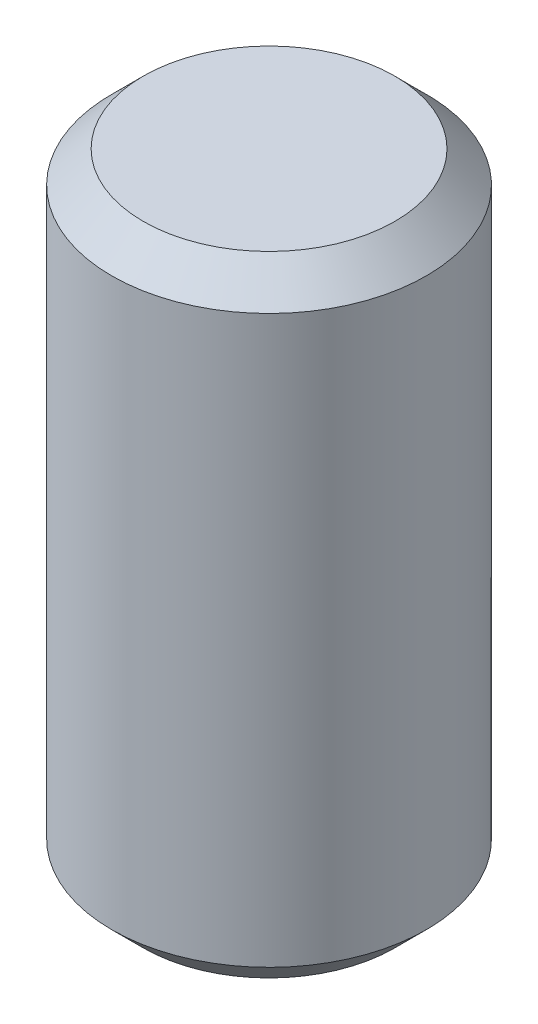
from build123d import *

# Parameters (mm, degrees)
SKETCH1_R           = 5
BOSS_EXTRUDE2_DEPTH = 20
CHAMFER1_SIZE       = 1


with BuildPart() as part:
    # Sketch1 → Boss-Extrude2 (new body)
    with BuildSketch(Plane(origin=(0, 0, 0), x_dir=(1, 0, 0), z_dir=(0, 1, 0))):
        with Locations(Location((-12.250469695, 8.54444525, 0), (0, 0, 270))):
            Circle(SKETCH1_R)
    extrude(amount=BOSS_EXTRUDE2_DEPTH)

    # Chamfer1
    chamfer1_edges = [part.edges().sort_by_distance(p)[0] for p in [
        (-12.250469695, 0, -13.54444525),
        (-12.250469695, 20, -13.54444525),
    ]]
    chamfer(chamfer1_edges, length=CHAMFER1_SIZE)


solid = part.part
